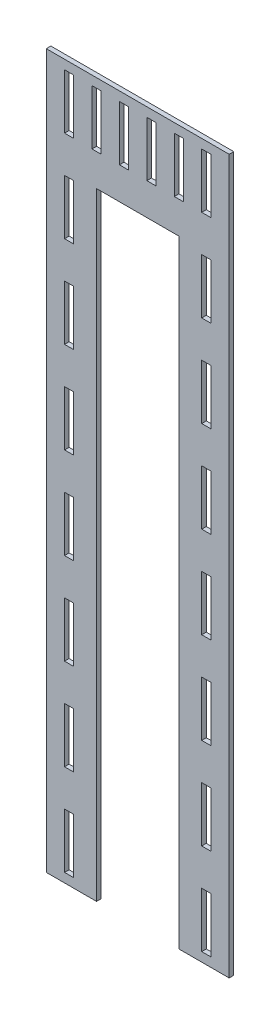
from build123d import *

# Parameters (mm, degrees)
EXTRUDE_1_DEPTH     = 0.5
SKETCH_3_W          = 1
SKETCH_3_H          = 6
CUT_EXTRUDE_1_DEPTH = 0.5


with BuildPart() as part:
    # 草图1 → 凸台-拉伸1 (new body)
    with BuildSketch(Plane.XY):
        Polygon((-4.5, 0), (-4.5, 67.5), (4.5, 67.5), (4.5, 0), (10, 0), (10, 78), (-10, 78), (-10, 0), align=None)
    extrude(amount=EXTRUDE_1_DEPTH)

    # 草图3 → 切除-拉伸1 (cut)
    with BuildSketch(Plane.XY.offset(0.5)):
        with Locations((-7.5, 74)):
            Rectangle(SKETCH_3_W, SKETCH_3_H)
        with Locations((-4.5, 74)):
            Rectangle(SKETCH_3_W, SKETCH_3_H)
        with Locations((-1.5, 74)):
            Rectangle(SKETCH_3_W, SKETCH_3_H)
        with Locations((1.5, 74)):
            Rectangle(SKETCH_3_W, SKETCH_3_H)
        with Locations((4.5, 74)):
            Rectangle(SKETCH_3_W, SKETCH_3_H)
        with Locations((7.5, 74)):
            Rectangle(SKETCH_3_W, SKETCH_3_H)
        with Locations((-7.5, 64)):
            Rectangle(SKETCH_3_W, SKETCH_3_H)
        with Locations((7.5, 64)):
            Rectangle(SKETCH_3_W, SKETCH_3_H)
        with Locations((-7.5, 54)):
            Rectangle(SKETCH_3_W, SKETCH_3_H)
        with Locations((7.5, 54)):
            Rectangle(SKETCH_3_W, SKETCH_3_H)
        with Locations((-7.5, 44)):
            Rectangle(SKETCH_3_W, SKETCH_3_H)
        with Locations((7.5, 44)):
            Rectangle(SKETCH_3_W, SKETCH_3_H)
        with Locations((-7.5, 34)):
            Rectangle(SKETCH_3_W, SKETCH_3_H)
        with Locations((7.5, 34)):
            Rectangle(SKETCH_3_W, SKETCH_3_H)
        with Locations((-7.5, 24)):
            Rectangle(SKETCH_3_W, SKETCH_3_H)
        with Locations((7.5, 24)):
            Rectangle(SKETCH_3_W, SKETCH_3_H)
        with Locations((-7.5, 14)):
            Rectangle(SKETCH_3_W, SKETCH_3_H)
        with Locations((7.5, 14)):
            Rectangle(SKETCH_3_W, SKETCH_3_H)
        with Locations((-7.5, 4)):
            Rectangle(SKETCH_3_W, SKETCH_3_H)
        with Locations((7.5, 4)):
            Rectangle(SKETCH_3_W, SKETCH_3_H)
    extrude(amount=-CUT_EXTRUDE_1_DEPTH, mode=Mode.SUBTRACT)


solid = part.part
